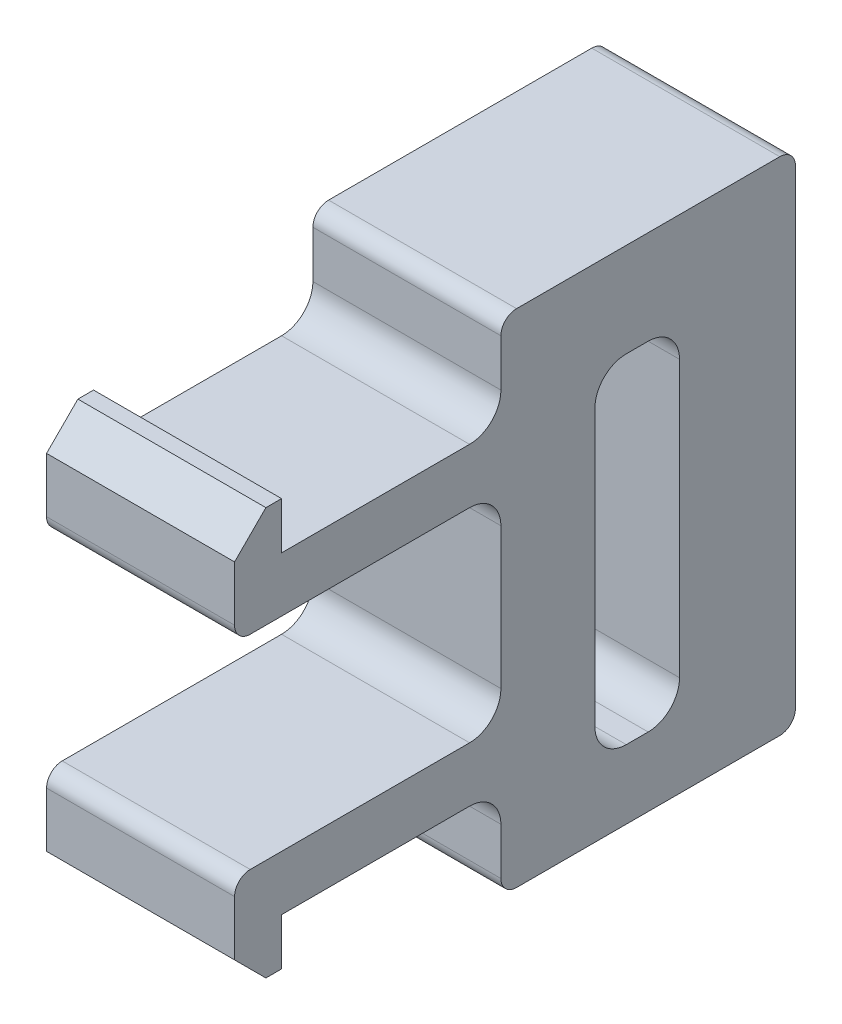
from build123d import *

# Parameters (mm, degrees)
ESQUISSE1_W             = 6
ESQUISSE1_H             = 16
EXTRUSION1_DEPTH        = 3.7
ESQUISSE2_W             = 6
ESQUISSE2_H             = 3
ESQUISSE2_W_2           = 3
ESQUISSE2_H_2           = 2.2
EXTRUSION2_DEPTH        = 2.7
ESQUISSE3_W             = 3
ESQUISSE3_H             = 11
ENL_V_MAT_EXTRU_1_DEPTH = 5
ESQUISSE4_W             = 6
ESQUISSE4_H             = 16
EXTRUSION3_DEPTH        = 3
EXTRUSION4_DEPTH        = 6
CHANFREIN1_SIZE         = 1
CONG_1_R                = 1
CONG_2_R                = 0.5
ENL_V_MAT_EXTRU_2_REACH = 78.526


with BuildPart() as part:
    # Esquisse1 → Extrusion1 (new body)
    with BuildSketch(Plane.XY):
        with Locations((55.8, 37.58978076)):
            Rectangle(ESQUISSE1_W, ESQUISSE1_H)
    extrude(amount=EXTRUSION1_DEPTH)

    # Esquisse2 → Extrusion2 (add)
    with BuildSketch(Plane.XY.offset(3.7)):
        with Locations((55.8, 44.08978076)):
            Rectangle(ESQUISSE2_W, ESQUISSE2_H)
        with Locations((57.3, 30.68978076)):
            Rectangle(ESQUISSE2_W_2, ESQUISSE2_H_2)
    extrude(amount=EXTRUSION2_DEPTH)

    # Esquisse3 → Enlèv. mat.-Extru.1 (cut)
    with BuildSketch(Plane.XY.offset(3.7)):
        with Locations((54.3, 35.08978076)):
            Rectangle(ESQUISSE3_W, ESQUISSE3_H)
    extrude(amount=-ENL_V_MAT_EXTRU_1_DEPTH, mode=Mode.SUBTRACT)

    # Esquisse4 → Extrusion3 (add)
    with BuildSketch(Plane.XY.offset(6.4)):
        with Locations((55.8, 37.58978076)):
            Rectangle(ESQUISSE4_W, ESQUISSE4_H)
    extrude(amount=EXTRUSION3_DEPTH)

    # Esquisse5 → Extrusion4 (add)
    with BuildSketch(Plane.ZY.offset(-52.8)):
        Polygon((8.183216319, 42.58978076), (16.4, 42.58978076), (16.4, 44.08978076), (17.9, 44.08978076), (17.9, 40.83978076), (9.2, 40.83978076), (9.2, 34.33978076), (17.9, 34.33978076), (17.9, 31.08978076), (16.4, 31.08978076), (16.4, 32.58978076), (8.183216319, 32.58978076), align=None)
    extrude(amount=-EXTRUSION4_DEPTH)

    # Chanfrein1
    chanfrein1_edges = [part.edges().sort_by_distance(p)[0] for p in [
        (55.8, 44.08978076, 17.9),
        (55.8, 31.08978076, 17.9),
    ]]
    chamfer(chanfrein1_edges, length=CHANFREIN1_SIZE)

    # Congé1
    cong_1_edges = [part.edges().sort_by_distance(p)[0] for p in [
        (55.8, 40.58978076, 1.85),
        (55.8, 42.58978076, 6.4),
        (55.8, 42.58978076, 3.7),
        (57.3, 31.78978076, 3.7),
        (57.3, 31.78978076, 6.4),
        (55.8, 34.33978076, 9.4),
        (55.8, 42.58978076, 9.4),
        (55.8, 32.58978076, 9.4),
        (55.8, 40.83978076, 9.4),
    ]]
    fillet(cong_1_edges, radius=CONG_1_R)

    # Congé2
    cong_2_edges = [part.edges().sort_by_distance(p)[0] for p in [
        (57.3, 29.58978076, 0),
        (55.8, 45.58978076, 0),
        (55.8, 29.58978076, 9.4),
        (55.8, 45.58978076, 9.4),
        (55.8, 40.83978076, 17.9),
        (55.8, 34.33978076, 17.9),
    ]]
    fillet(cong_2_edges, radius=CONG_2_R)

    # Enlèv. mat.-Extru.2: up to this face of the body (flat: up to its plane)
    enl_v_mat_extru_2_end = Plane(part.part.faces().sort_by_distance((55.569230769, 36.266703837, 6.4))[0])
    # Esquisse6 → Enlèv. mat.-Extru.2 (cut, up to the picked face)
    with BuildSketch(Plane(origin=(0, 0, 0), x_dir=(-1, 0, 0), z_dir=(0, 0, -1)), mode=Mode.PRIVATE) as enl_v_mat_extru_2_sk1:
        Polygon((-56.8, 29.58978076), (-52.381825652, 46.078631902), (-52.381825652, 29.58978076), align=None)
    enl_v_mat_extru_2_tool1 = split(extrude(enl_v_mat_extru_2_sk1.sketch, amount=-ENL_V_MAT_EXTRU_2_REACH, mode=Mode.PRIVATE), bisect_by=enl_v_mat_extru_2_end, keep=Keep.BOTH, mode=Mode.PRIVATE)
    add(enl_v_mat_extru_2_tool1.solids().sort_by(Axis((53.85455, 35.086064, 0), (0, 0, 1)))[0], mode=Mode.SUBTRACT)


solid = part.part
